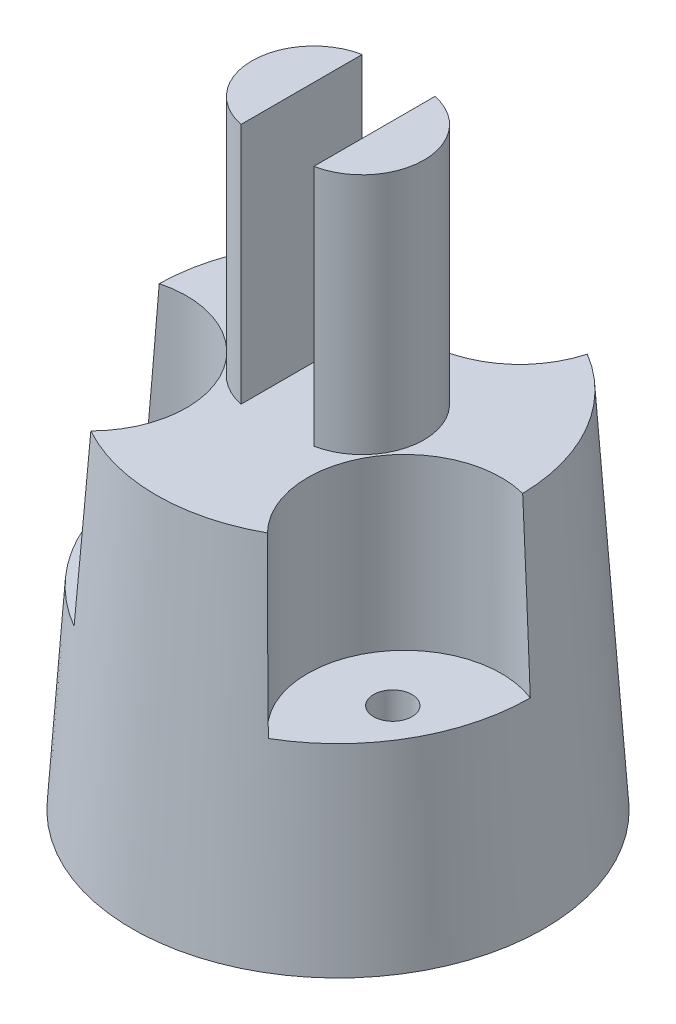
from build123d import *

# Parameters (mm, degrees)
CUT_EXTRUDE4_REACH  = 21.219
SKETCH5_R           = 0.79375
SKETCH4_R           = 4
CUT_EXTRUDE3_DEPTH  = 7
BOSS_EXTRUDE1_DEPTH = 10


with BuildPart() as part:
    # Sketch1 → Revolve1 (revolve)
    with BuildSketch(Plane.XY, mode=Mode.PRIVATE) as revolve1_sk:
        Polygon((0, 0), (8.496, 0), (7.5, 15), (3.5, 15), (0, 15), align=None)
    revolve(revolve1_sk.sketch.rotate(Axis((0, 15, 0), (0, -1, 0)), 180), axis=Axis((0, 15, 0), (0, -1, 0)))

    # Sketch5 → Cut-Extrude4 (cut, up to next)
    with BuildSketch(Plane.XZ, mode=Mode.PRIVATE) as cut_extrude4_sk1:
        with Locations((5.401571729, 3.140943396)):
            Circle(SKETCH5_R)
    cut_extrude4_tool1 = extrude(cut_extrude4_sk1.sketch, amount=-CUT_EXTRUDE4_REACH, mode=Mode.PRIVATE) & part.part
    # Sketch5 → Cut-Extrude4 (cut, up to next)
    with BuildSketch(Plane.XZ, mode=Mode.PRIVATE) as cut_extrude4_sk2:
        with Locations((0.019350908, -6.248370036)):
            Circle(SKETCH5_R)
    cut_extrude4_tool2 = extrude(cut_extrude4_sk2.sketch, amount=-CUT_EXTRUDE4_REACH, mode=Mode.PRIVATE) & part.part
    # Sketch5 → Cut-Extrude4 (cut, up to next)
    with BuildSketch(Plane.XZ, mode=Mode.PRIVATE) as cut_extrude4_sk3:
        with Locations((-5.420922637, 3.10742664)):
            Circle(SKETCH5_R)
    cut_extrude4_tool3 = extrude(cut_extrude4_sk3.sketch, amount=-CUT_EXTRUDE4_REACH, mode=Mode.PRIVATE) & part.part
    add(cut_extrude4_tool1.solids().sort_by_distance((5.401572, 0, 3.140943))[0], mode=Mode.SUBTRACT)
    add(cut_extrude4_tool2.solids().sort_by_distance((0.019351, 0, -6.24837))[0], mode=Mode.SUBTRACT)
    add(cut_extrude4_tool3.solids().sort_by_distance((-5.420923, 0, 3.107427))[0], mode=Mode.SUBTRACT)

    # Sketch4 → Cut-Extrude3 (cut)
    with BuildSketch(Plane(origin=(0, 15, 0), x_dir=(1, 0, 0), z_dir=(0, 1, 0))):
        with Locations((0, 7.5)):
            Circle(SKETCH4_R)
        with Locations((6.495190528, -3.75)):
            Circle(SKETCH4_R)
        with Locations((-6.495190528, -3.75)):
            Circle(SKETCH4_R)
    extrude(amount=-CUT_EXTRUDE3_DEPTH, mode=Mode.SUBTRACT)

    # Sketch8 → Boss-Extrude1 (add)
    with BuildSketch(Plane(origin=(0, 15, 0), x_dir=(1, 0, 0), z_dir=(0, 1, 0))):
        with BuildLine():
            Line((1.5, 2.5), (1.5, -2.5))
            ThreePointArc((1.5, -2.5), (3.549509757, 0), (1.5, 2.5))
        make_face()
        with BuildLine():
            Line((-1.5, 2.5), (-1.5, -2.5))
            ThreePointArc((-1.5, -2.5), (-3.549509757, 0), (-1.5, 2.5))
        make_face()
    extrude(amount=BOSS_EXTRUDE1_DEPTH)


solid = part.part
